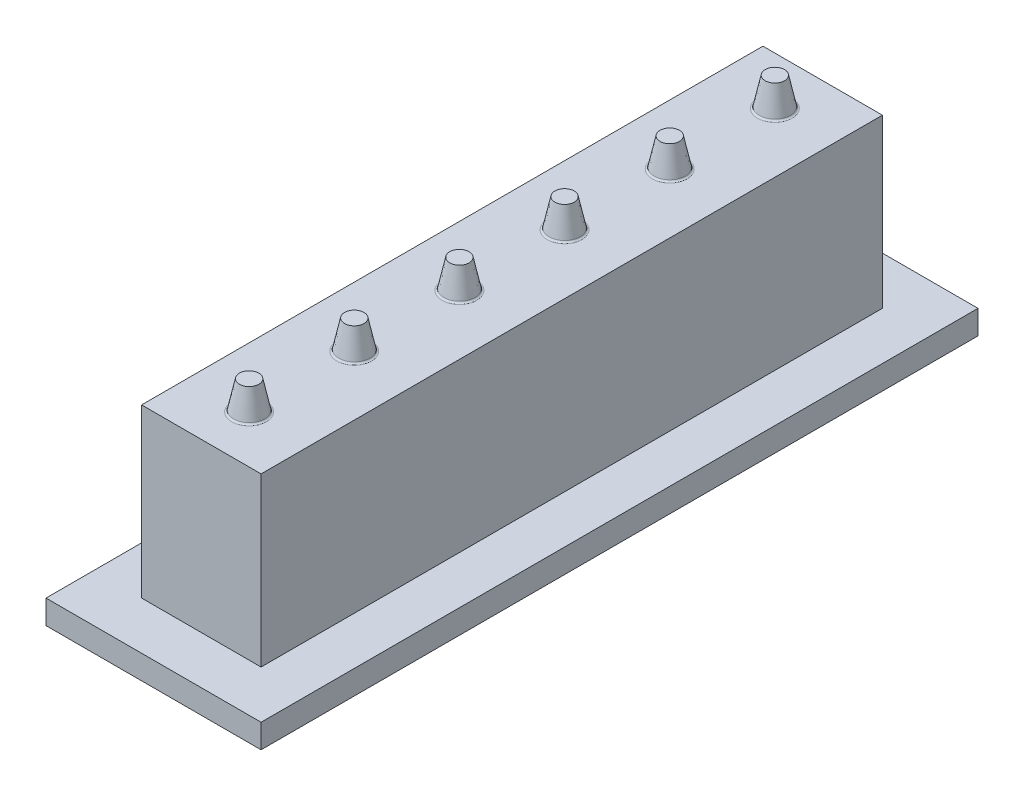
from build123d import *

# Parameters (mm, degrees)
SKETCH1_W                     = 31.75
SKETCH1_H                     = 50.8
BOSS_EXTRUDE1_DEPTH           = 165.1
SKETCH2_R                     = 4.191
BOSS_EXTRUDE2_DEPTH           = 7.62
BOSS_EXTRUDE2_DRAFT           = 12
BOSS_EXTRUDE2_PROFILE_2_DEPTH = 7.62
BOSS_EXTRUDE2_PROFILE_2_DRAFT = 12
BOSS_EXTRUDE2_PROFILE_3_DEPTH = 7.62
BOSS_EXTRUDE2_PROFILE_3_DRAFT = 12
BOSS_EXTRUDE2_PROFILE_4_DEPTH = 7.62
BOSS_EXTRUDE2_PROFILE_4_DRAFT = 12
BOSS_EXTRUDE2_PROFILE_5_DEPTH = 7.62
BOSS_EXTRUDE2_PROFILE_5_DRAFT = 12
BOSS_EXTRUDE2_PROFILE_6_DEPTH = 7.62
BOSS_EXTRUDE2_PROFILE_6_DRAFT = 12
FILLET2_R                     = 0.508
SKETCH3_W                     = 19.05
SKETCH3_H                     = 152.4
CUT_EXTRUDE1_DEPTH            = 44.45
SKETCH4_W                     = 57.15
SKETCH4_H                     = 190.5
SKETCH4_W_2                   = 31.75
SKETCH4_H_2                   = 165.1
BOSS_EXTRUDE3_DEPTH           = 6.35


with BuildPart() as part:
    # Sketch1 → Boss-Extrude1 (new body)
    with BuildSketch(Plane.XY):
        with Locations((15.875, 25.4)):
            Rectangle(SKETCH1_W, SKETCH1_H)
    extrude(amount=BOSS_EXTRUDE1_DEPTH)


with BuildPart() as boss_extrude2_tool:
    # Sketch2 → Boss-Extrude2 (with draft: the straight prism first)
    with BuildSketch(Plane(origin=(0, 50.8, 0), x_dir=(1, 0, 0), z_dir=(0, 1, 0))):
        with Locations((15.875, -12.7)):
            Circle(SKETCH2_R)
    extrude(amount=BOSS_EXTRUDE2_DEPTH)
    # Boss-Extrude2: the draft: its side faces are tilted about the plane it starts from
    boss_extrude2_sides = [boss_extrude2_tool.faces().sort_by_distance(p)[0] for p in [
        (11.684, 54.61, 12.7),
    ]]
    draft(boss_extrude2_sides, Plane(origin=(0, 50.8, 0), x_dir=(1, 0, 0), z_dir=(0, 1, 0)), BOSS_EXTRUDE2_DRAFT)


with BuildPart() as part_1:
    add(part.part)

    # Boss-Extrude2: add boss_extrude2_tool
    add(boss_extrude2_tool.part)


with BuildPart() as boss_extrude2_profile_2_tool:
    # Sketch2 → Boss-Extrude2 profile 2 (with draft: the straight prism first)
    with BuildSketch(Plane(origin=(0, 50.8, 0), x_dir=(1, 0, 0), z_dir=(0, 1, 0))):
        with Locations((15.875, -40.64)):
            Circle(SKETCH2_R)
    extrude(amount=BOSS_EXTRUDE2_PROFILE_2_DEPTH)
    # Boss-Extrude2 profile 2: the draft: its side faces are tilted about the plane it starts from
    boss_extrude2_profile_2_sides = [boss_extrude2_profile_2_tool.faces().sort_by_distance(p)[0] for p in [
        (11.684, 54.61, 40.64),
    ]]
    draft(boss_extrude2_profile_2_sides, Plane(origin=(0, 50.8, 0), x_dir=(1, 0, 0), z_dir=(0, 1, 0)), BOSS_EXTRUDE2_PROFILE_2_DRAFT)


with BuildPart() as part_2:
    add(part_1.part)

    # Boss-Extrude2 profile 2: add boss_extrude2_profile_2_tool
    add(boss_extrude2_profile_2_tool.part)


with BuildPart() as boss_extrude2_profile_3_tool:
    # Sketch2 → Boss-Extrude2 profile 3 (with draft: the straight prism first)
    with BuildSketch(Plane(origin=(0, 50.8, 0), x_dir=(1, 0, 0), z_dir=(0, 1, 0))):
        with Locations((15.875, -68.58)):
            Circle(SKETCH2_R)
    extrude(amount=BOSS_EXTRUDE2_PROFILE_3_DEPTH)
    # Boss-Extrude2 profile 3: the draft: its side faces are tilted about the plane it starts from
    boss_extrude2_profile_3_sides = [boss_extrude2_profile_3_tool.faces().sort_by_distance(p)[0] for p in [
        (11.684, 54.61, 68.58),
    ]]
    draft(boss_extrude2_profile_3_sides, Plane(origin=(0, 50.8, 0), x_dir=(1, 0, 0), z_dir=(0, 1, 0)), BOSS_EXTRUDE2_PROFILE_3_DRAFT)


with BuildPart() as part_3:
    add(part_2.part)

    # Boss-Extrude2 profile 3: add boss_extrude2_profile_3_tool
    add(boss_extrude2_profile_3_tool.part)


with BuildPart() as boss_extrude2_profile_4_tool:
    # Sketch2 → Boss-Extrude2 profile 4 (with draft: the straight prism first)
    with BuildSketch(Plane(origin=(0, 50.8, 0), x_dir=(1, 0, 0), z_dir=(0, 1, 0))):
        with Locations((15.875, -96.52)):
            Circle(SKETCH2_R)
    extrude(amount=BOSS_EXTRUDE2_PROFILE_4_DEPTH)
    # Boss-Extrude2 profile 4: the draft: its side faces are tilted about the plane it starts from
    boss_extrude2_profile_4_sides = [boss_extrude2_profile_4_tool.faces().sort_by_distance(p)[0] for p in [
        (11.684, 54.61, 96.52),
    ]]
    draft(boss_extrude2_profile_4_sides, Plane(origin=(0, 50.8, 0), x_dir=(1, 0, 0), z_dir=(0, 1, 0)), BOSS_EXTRUDE2_PROFILE_4_DRAFT)


with BuildPart() as part_4:
    add(part_3.part)

    # Boss-Extrude2 profile 4: add boss_extrude2_profile_4_tool
    add(boss_extrude2_profile_4_tool.part)


with BuildPart() as boss_extrude2_profile_5_tool:
    # Sketch2 → Boss-Extrude2 profile 5 (with draft: the straight prism first)
    with BuildSketch(Plane(origin=(0, 50.8, 0), x_dir=(1, 0, 0), z_dir=(0, 1, 0))):
        with Locations((15.875, -124.46)):
            Circle(SKETCH2_R)
    extrude(amount=BOSS_EXTRUDE2_PROFILE_5_DEPTH)
    # Boss-Extrude2 profile 5: the draft: its side faces are tilted about the plane it starts from
    boss_extrude2_profile_5_sides = [boss_extrude2_profile_5_tool.faces().sort_by_distance(p)[0] for p in [
        (11.684, 54.61, 124.46),
    ]]
    draft(boss_extrude2_profile_5_sides, Plane(origin=(0, 50.8, 0), x_dir=(1, 0, 0), z_dir=(0, 1, 0)), BOSS_EXTRUDE2_PROFILE_5_DRAFT)


with BuildPart() as part_5:
    add(part_4.part)

    # Boss-Extrude2 profile 5: add boss_extrude2_profile_5_tool
    add(boss_extrude2_profile_5_tool.part)


with BuildPart() as boss_extrude2_profile_6_tool:
    # Sketch2 → Boss-Extrude2 profile 6 (with draft: the straight prism first)
    with BuildSketch(Plane(origin=(0, 50.8, 0), x_dir=(1, 0, 0), z_dir=(0, 1, 0))):
        with Locations((15.875, -152.4)):
            Circle(SKETCH2_R)
    extrude(amount=BOSS_EXTRUDE2_PROFILE_6_DEPTH)
    # Boss-Extrude2 profile 6: the draft: its side faces are tilted about the plane it starts from
    boss_extrude2_profile_6_sides = [boss_extrude2_profile_6_tool.faces().sort_by_distance(p)[0] for p in [
        (11.684, 54.61, 152.4),
    ]]
    draft(boss_extrude2_profile_6_sides, Plane(origin=(0, 50.8, 0), x_dir=(1, 0, 0), z_dir=(0, 1, 0)), BOSS_EXTRUDE2_PROFILE_6_DRAFT)


with BuildPart() as part_6:
    add(part_5.part)

    # Boss-Extrude2 profile 6: add boss_extrude2_profile_6_tool
    add(boss_extrude2_profile_6_tool.part)

    # Fillet2
    fillet2_edges = [part_6.edges().sort_by_distance(p)[0] for p in [
        (11.684, 50.8, 12.7),
        (11.684, 50.8, 40.64),
        (11.684, 50.8, 68.58),
        (11.684, 50.8, 96.52),
        (11.684, 50.8, 124.46),
        (11.684, 50.8, 152.4),
    ]]
    fillet(fillet2_edges, radius=FILLET2_R)

    # Sketch3 → Cut-Extrude1 (cut)
    with BuildSketch(Plane(origin=(0, 0, 0), x_dir=(-1, 0, 0), z_dir=(0, -1, 0))):
        with Locations((-15.875, -82.55)):
            Rectangle(SKETCH3_W, SKETCH3_H)
    extrude(amount=-CUT_EXTRUDE1_DEPTH, mode=Mode.SUBTRACT)

    # Sketch4 → Boss-Extrude3 (add)
    with BuildSketch(Plane(origin=(0, 0, 0), x_dir=(-1, 0, 0), z_dir=(0, -1, 0))):
        with Locations((-15.875, -82.55)):
            Rectangle(SKETCH4_W, SKETCH4_H)
        with Locations((-15.875, -82.55)):
            Rectangle(SKETCH4_W_2, SKETCH4_H_2, mode=Mode.SUBTRACT)
    extrude(amount=-BOSS_EXTRUDE3_DEPTH)


solid = part_6.part
